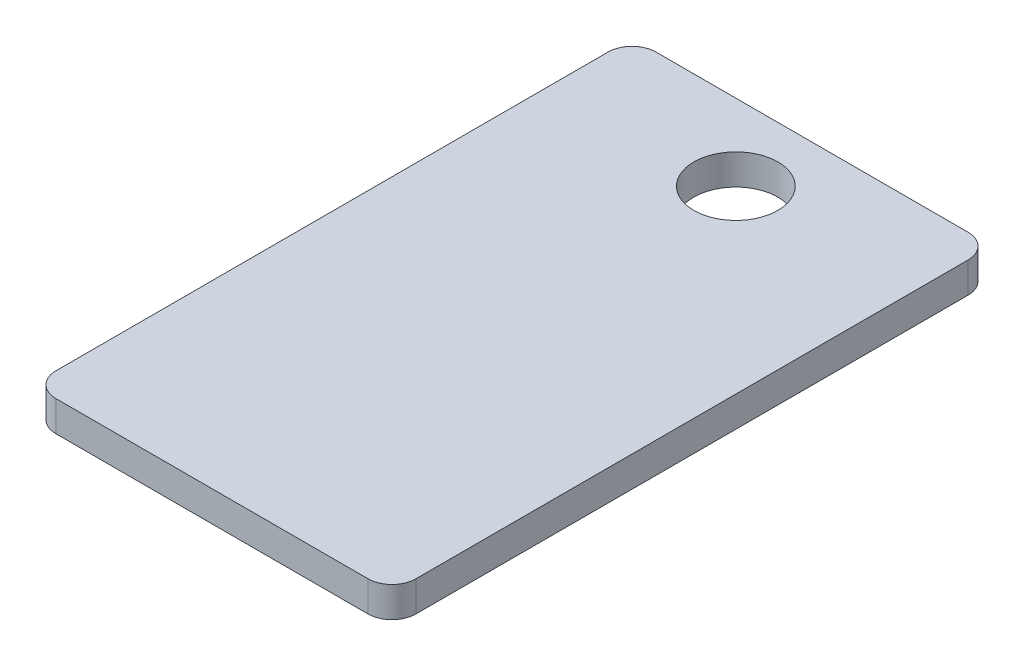
from build123d import *

# Parameters (mm, degrees)
SKETCH1_W           = 15
SKETCH1_H           = 25
SKETCH1_R           = 1.75
BOSS_EXTRUDE1_DEPTH = 1.27
FILLET1_R           = 1


with BuildPart() as part:
    # Sketch1 → Boss-Extrude1 (new body)
    with BuildSketch(Plane(origin=(0, 0, 0), x_dir=(1, 0, 0), z_dir=(0, 1, 0))):
        with Locations((7.5, -12.5)):
            Rectangle(SKETCH1_W, SKETCH1_H)
        with Locations(Location((7.5, -3.175, 0), (0, 0, 270))):
            Circle(SKETCH1_R, mode=Mode.SUBTRACT)
    extrude(amount=BOSS_EXTRUDE1_DEPTH)

    # Fillet1
    fillet1_edges = [part.edges().sort_by_distance(p)[0] for p in [
        (0, 0.635, 0),
        (15, 0.635, 0),
        (15, 0.635, 25),
        (0, 0.635, 25),
    ]]
    fillet(fillet1_edges, radius=FILLET1_R)


solid = part.part
